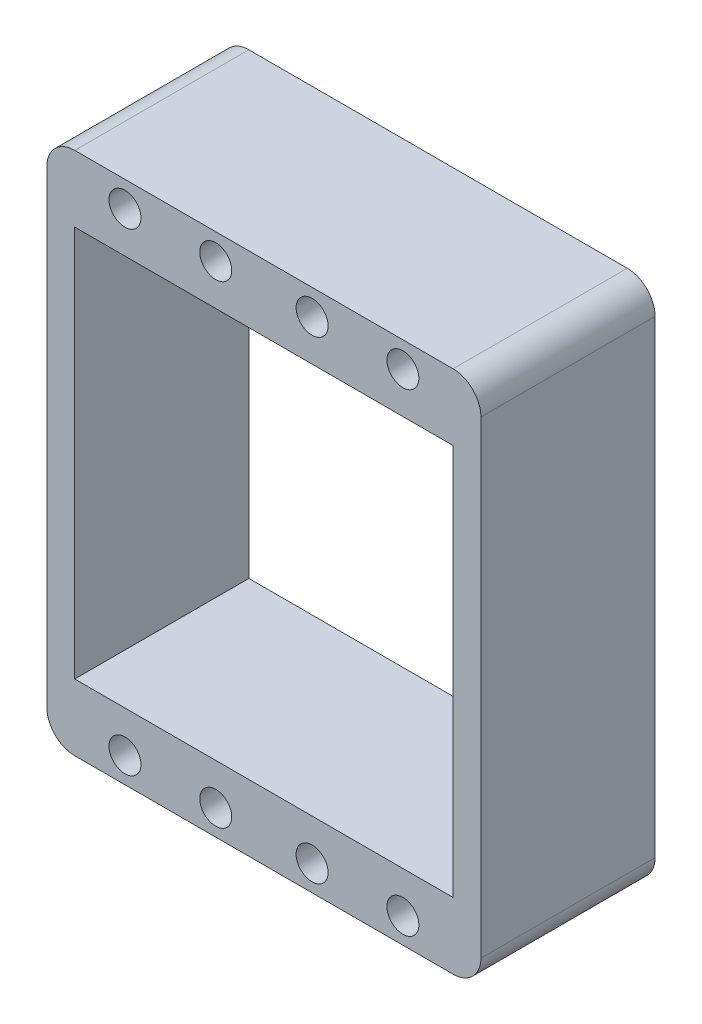
from build123d import *

# Parameters (mm, degrees)
SKETCH1_W           = 46.85
SKETCH1_H           = 56.6
SKETCH1_R           = 1.725
SKETCH1_W_2         = 40.85
SKETCH1_H_2         = 42.25
BOSS_EXTRUDE1_DEPTH = 18.8
FILLET1_R           = 3


with BuildPart() as part:
    # Sketch1 → Boss-Extrude1 (new body)
    with BuildSketch(Plane.XY):
        Rectangle(SKETCH1_W, SKETCH1_H)
        with Locations((-15, -25.55)):
            Circle(SKETCH1_R, mode=Mode.SUBTRACT)
        with Locations((-5.2, -25.55)):
            Circle(SKETCH1_R, mode=Mode.SUBTRACT)
        with Locations((5.2, -25.55)):
            Circle(SKETCH1_R, mode=Mode.SUBTRACT)
        with Locations((15, -25.55)):
            Circle(SKETCH1_R, mode=Mode.SUBTRACT)
        with Locations((15, 25.55)):
            Circle(SKETCH1_R, mode=Mode.SUBTRACT)
        with Locations((5.2, 25.55)):
            Circle(SKETCH1_R, mode=Mode.SUBTRACT)
        with Locations((-5.2, 25.55)):
            Circle(SKETCH1_R, mode=Mode.SUBTRACT)
        with Locations((-15, 25.55)):
            Circle(SKETCH1_R, mode=Mode.SUBTRACT)
        Rectangle(SKETCH1_W_2, SKETCH1_H_2, mode=Mode.SUBTRACT)
    extrude(amount=BOSS_EXTRUDE1_DEPTH)

    # Fillet1
    fillet1_edges = [part.edges().sort_by_distance(p)[0] for p in [
        (-23.425, -28.3, 9.4),
        (23.425, -28.3, 9.4),
        (23.425, 28.3, 9.4),
        (-23.425, 28.3, 9.4),
    ]]
    fillet(fillet1_edges, radius=FILLET1_R)


solid = part.part
